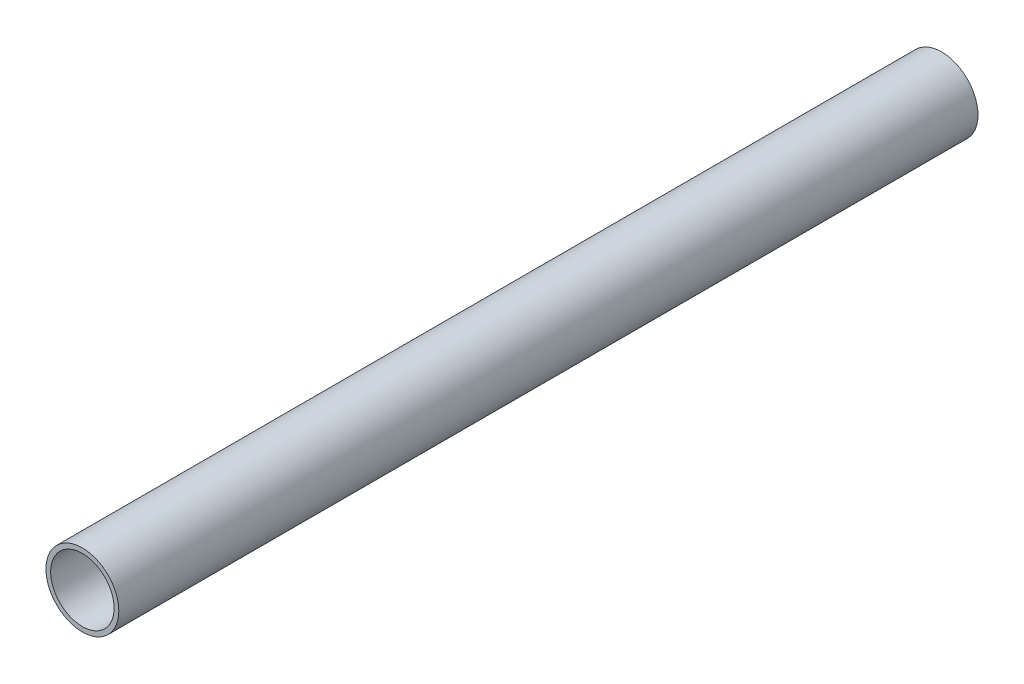
from build123d import *

# Parameters (mm, degrees)
SKETCH1_R           = 30.1625
SKETCH1_R_2         = 26.2509
BOSS_EXTRUDE1_DEPTH = 711.2


with BuildPart() as part:
    # Sketch1 → Boss-Extrude1 (new body)
    with BuildSketch(Plane.XY):
        Circle(SKETCH1_R)
        Circle(SKETCH1_R_2, mode=Mode.SUBTRACT)
    extrude(amount=BOSS_EXTRUDE1_DEPTH)


solid = part.part
